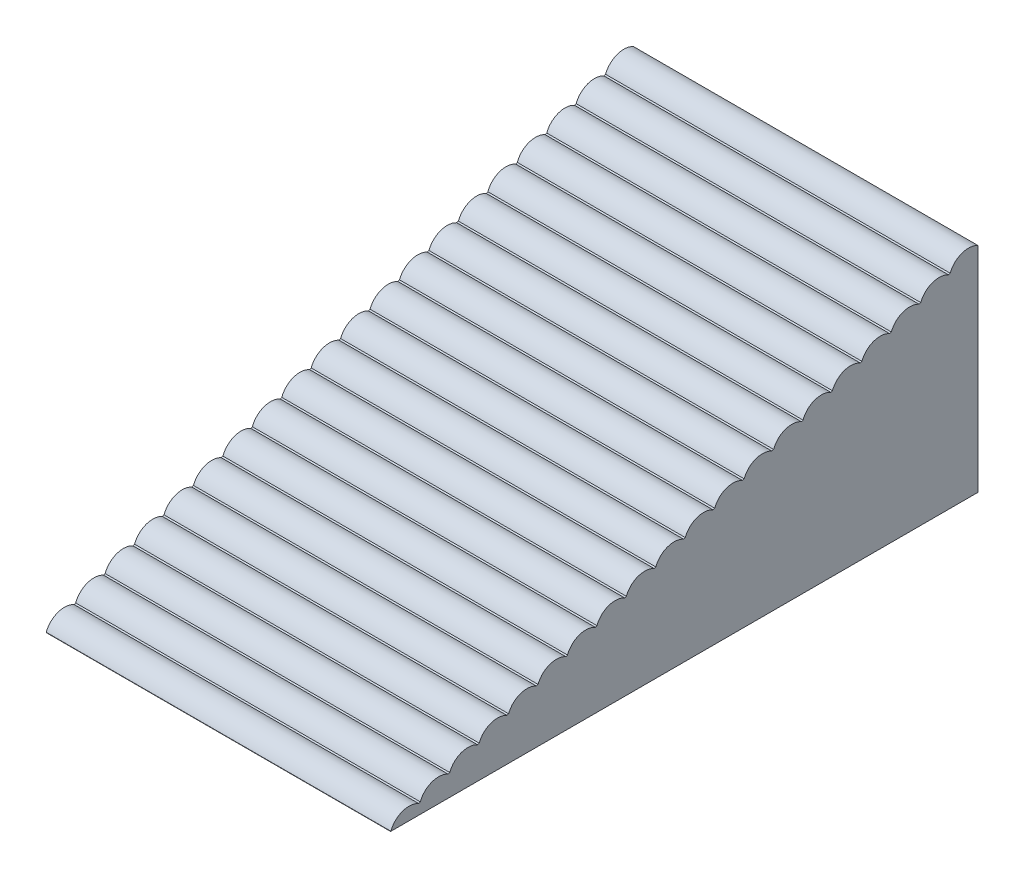
from build123d import *

# Parameters (mm, degrees)
BOSS_EXTRUDE1_DEPTH = 8.8
BOSS_EXTRUDE3_DEPTH = 8.8


with BuildPart() as part:
    # Sketch1 → Boss-Extrude1 (new body)
    with BuildSketch(Plane(origin=(0, 0, 0), x_dir=(0, 0, -1), z_dir=(1, 0, 0))):
        Polygon((0, 0), (15, 5.459553514), (15, 0), align=None)
    extrude(amount=BOSS_EXTRUDE1_DEPTH)

    # Sketch2 → Boss-Extrude3 (add)
    with BuildSketch(Plane.ZY):
        with BuildLine():
            Line((-15, 5.459553514), (-14.289665454, 5.201012883))
            ThreePointArc((-14.289665454, 5.201012883), (-14.585776352, 5.492539256), (-15, 5.459553514))
        make_face()
        with BuildLine():
            Line((-14.248245903, 5.185937399), (-13.537911358, 4.927396768))
            ThreePointArc((-13.537911358, 4.927396768), (-13.834022255, 5.218923141), (-14.248245903, 5.185937399))
        make_face()
        with BuildLine():
            Line((-13.496491807, 4.912321285), (-12.786157261, 4.653780654))
            ThreePointArc((-12.786157261, 4.653780654), (-13.082268159, 4.945307027), (-13.496491807, 4.912321285))
        make_face()
        with BuildLine():
            Line((-12.74473771, 4.63870517), (-12.034403164, 4.380164539))
            ThreePointArc((-12.034403164, 4.380164539), (-12.330514062, 4.671690912), (-12.74473771, 4.63870517))
        make_face()
        with BuildLine():
            Line((-11.992983613, 4.365089055), (-11.282649068, 4.106548424))
            ThreePointArc((-11.282649068, 4.106548424), (-11.578759965, 4.398074797), (-11.992983613, 4.365089055))
        make_face()
        with BuildLine():
            Line((-11.241229517, 4.091472941), (-10.530894971, 3.83293231))
            ThreePointArc((-10.530894971, 3.83293231), (-10.827005869, 4.124458683), (-11.241229517, 4.091472941))
        make_face()
        with BuildLine():
            Line((-10.48947542, 3.817856826), (-9.779140875, 3.559316195))
            ThreePointArc((-9.779140875, 3.559316195), (-10.075251772, 3.850842568), (-10.48947542, 3.817856826))
        make_face()
        with BuildLine():
            Line((-9.737721324, 3.544240711), (-9.027386778, 3.28570008))
            ThreePointArc((-9.027386778, 3.28570008), (-9.323497675, 3.577226453), (-9.737721324, 3.544240711))
        make_face()
        with BuildLine():
            Line((-8.985967227, 3.270624597), (-8.275632681, 3.012083966))
            ThreePointArc((-8.275632681, 3.012083966), (-8.571743579, 3.303610339), (-8.985967227, 3.270624597))
        make_face()
        with BuildLine():
            Line((-8.23421313, 2.997008482), (-7.523878585, 2.738467851))
            ThreePointArc((-7.523878585, 2.738467851), (-7.819989482, 3.029994224), (-8.23421313, 2.997008482))
        make_face()
        with BuildLine():
            Line((-7.482459034, 2.723392367), (-6.772124488, 2.464851736))
            ThreePointArc((-6.772124488, 2.464851736), (-7.068235386, 2.756378109), (-7.482459034, 2.723392367))
        make_face()
        with BuildLine():
            Line((-6.730704937, 2.449776253), (-6.020370391, 2.191235622))
            ThreePointArc((-6.020370391, 2.191235622), (-6.316481289, 2.482761995), (-6.730704937, 2.449776253))
        make_face()
        with BuildLine():
            Line((-5.97895084, 2.176160138), (-5.268616295, 1.917619507))
            ThreePointArc((-5.268616295, 1.917619507), (-5.564727192, 2.20914588), (-5.97895084, 2.176160138))
        make_face()
        with BuildLine():
            Line((-5.227196744, 1.902544023), (-4.516862198, 1.644003392))
            ThreePointArc((-4.516862198, 1.644003392), (-4.812973096, 1.935529765), (-5.227196744, 1.902544023))
        make_face()
        with BuildLine():
            Line((-4.475442647, 1.628927909), (-3.765108101, 1.370387278))
            ThreePointArc((-3.765108101, 1.370387278), (-4.061218999, 1.661913651), (-4.475442647, 1.628927909))
        make_face()
        with BuildLine():
            Line((-3.723688551, 1.355311794), (-3.013354005, 1.096771163))
            ThreePointArc((-3.013354005, 1.096771163), (-3.309464902, 1.388297536), (-3.723688551, 1.355311794))
        make_face()
        with BuildLine():
            Line((-2.971934454, 1.081695679), (-2.261599908, 0.823155048))
            ThreePointArc((-2.261599908, 0.823155048), (-2.557710806, 1.114681421), (-2.971934454, 1.081695679))
        make_face()
        with BuildLine():
            Line((-2.220180357, 0.808079565), (-1.509845812, 0.549538934))
            ThreePointArc((-1.509845812, 0.549538934), (-1.805956709, 0.841065307), (-2.220180357, 0.808079565))
        make_face()
        with BuildLine():
            Line((-1.468426261, 0.53446345), (-0.758091715, 0.275922819))
            ThreePointArc((-0.758091715, 0.275922819), (-1.054202613, 0.567449192), (-1.468426261, 0.53446345))
        make_face()
        with BuildLine():
            Line((-0.716672164, 0.260847335), (-0.006337618, 0.002306704))
            ThreePointArc((-0.006337618, 0.002306704), (-0.302448516, 0.293833077), (-0.716672164, 0.260847335))
        make_face()
    extrude(amount=-BOSS_EXTRUDE3_DEPTH)


solid = part.part
